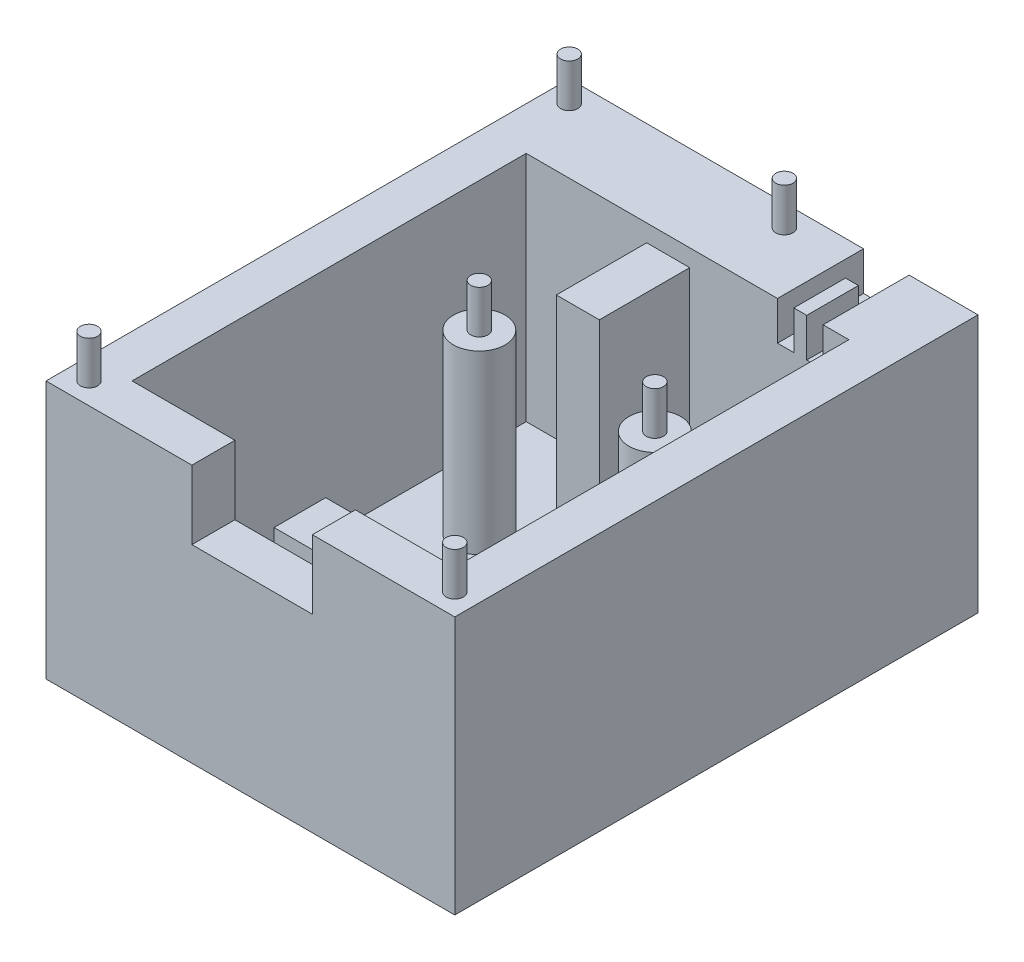
from build123d import *

# Parameters (mm, degrees)
SKETCH_1_W          = 47.5
SKETCH_1_H          = 60.8
EXTRUDE_1_DEPTH     = 30
SKETCH_2_R          = 1
EXTRUDE_3_DEPTH     = 5
SKETCH_3_W          = 37.5
SKETCH_3_H          = 45.8
CUT_EXTRUDE_1_DEPTH = 27
SKETCH_4_W          = 14
SKETCH_4_H          = 5
CUT_EXTRUDE_2_DEPTH = 8
SKETCH_5_R          = 3
SKETCH_5_W          = 6
SKETCH_5_H          = 6
EXTRUDE_4_DEPTH     = 20.5
SKETCH_6_W          = 5
SKETCH_6_H          = 10.5
EXTRUDE_6_DEPTH     = 25
SKETCH_7_R          = 1
EXTRUDE_7_DEPTH     = 5
SKETCH_12_W         = 5.3
SKETCH_12_H         = 4.5
CUT_EXTRUDE_5_DEPTH = 10
SKETCH_13_W         = 1.5
SKETCH_13_H         = 6
EXTRUDE_8_DEPTH     = 4.5


with BuildPart() as part:
    # 草图1 → 凸台-拉伸1 (new body)
    with BuildSketch(Plane(origin=(0, 0, 0), x_dir=(1, 0, 0), z_dir=(0, 1, 0))):
        with Locations((-26.283333333, -1.583333333)):
            Rectangle(SKETCH_1_W, SKETCH_1_H)
    extrude(amount=EXTRUDE_1_DEPTH)

    # 草图2 → 凸台-拉伸3 (add)
    with BuildSketch(Plane(origin=(0, 30, 0), x_dir=(1, 0, 0), z_dir=(0, 1, 0))):
        with Locations(Location((-22.533333333, 26.316666667, 0), (0, 0, 270))):
            Circle(SKETCH_2_R)
        with Locations(Location((-47.533333333, 26.316666667, 0), (0, 0, 270))):
            Circle(SKETCH_2_R)
        with Locations(Location((-47.533333333, -29.483333333, 0), (0, 0, 270))):
            Circle(SKETCH_2_R)
        with Locations(Location((-5.033333333, -29.483333333, 0), (0, 0, 270))):
            Circle(SKETCH_2_R)
    extrude(amount=EXTRUDE_3_DEPTH)

    # 草图3 → 切除-拉伸1 (cut)
    with BuildSketch(Plane(origin=(0, 30, 0), x_dir=(1, 0, 0), z_dir=(0, 1, 0))):
        with Locations((-26.283333333, -4.083333333)):
            Rectangle(SKETCH_3_W, SKETCH_3_H)
    extrude(amount=-CUT_EXTRUDE_1_DEPTH, mode=Mode.SUBTRACT)

    # 草图4 → 切除-拉伸2 (cut)
    with BuildSketch(Plane(origin=(0, 30, 0), x_dir=(1, 0, 0), z_dir=(0, 1, 0))):
        with Locations((-26.083333333, -29.483333333)):
            Rectangle(SKETCH_4_W, SKETCH_4_H)
    extrude(amount=-CUT_EXTRUDE_2_DEPTH, mode=Mode.SUBTRACT)

    # 草图5 → 凸台-拉伸4 (add)
    with BuildSketch(Plane(origin=(0, 3, 0), x_dir=(1, 0, 0), z_dir=(0, 1, 0))):
        with Locations(Location((-16.083333333, 4.816666667, 0), (0, 0, 270))):
            Circle(SKETCH_5_R)
        with Locations(Location((-36.483333333, 4.816666667, 0), (0, 0, 270))):
            Circle(SKETCH_5_R)
        with Locations((-25.533333333, -23.983333333)):
            Rectangle(SKETCH_5_W, SKETCH_5_H)
    extrude(amount=EXTRUDE_4_DEPTH)

    # 草图6 → 凸台-拉伸6 (add)
    with BuildSketch(Plane(origin=(0, 3, 0), x_dir=(1, 0, 0), z_dir=(0, 1, 0))):
        with Locations((-28.533333333, 13.566666667)):
            Rectangle(SKETCH_6_W, SKETCH_6_H)
    extrude(amount=EXTRUDE_6_DEPTH)

    # 草图7 → 凸台-拉伸7 (add)
    with BuildSketch(Plane(origin=(0, 23.5, 0), x_dir=(1, 0, 0), z_dir=(0, 1, 0))):
        with Locations(Location((-36.483333333, 4.816666667, 0), (0, 0, 270))):
            Circle(SKETCH_7_R)
        with Locations(Location((-16.083333333, 4.816666667, 0), (0, 0, 270))):
            Circle(SKETCH_7_R)
    extrude(amount=EXTRUDE_7_DEPTH)

    # 草图12 → 切除-拉伸5 (cut)
    with BuildSketch(Plane(origin=(0, 0, -28.816666667), x_dir=(-1, 0, 0), z_dir=(0, 0, -1))):
        with Locations((13.183333333, 27.75)):
            Rectangle(SKETCH_12_W, SKETCH_12_H)
    extrude(amount=-CUT_EXTRUDE_5_DEPTH, mode=Mode.SUBTRACT)

    # 草图13 → 凸台-拉伸8 (add)
    with BuildSketch(Plane(origin=(0, 25.5, 0), x_dir=(1, 0, 0), z_dir=(0, 1, 0))):
        with Locations((-13.183333333, 21.816666667)):
            Rectangle(SKETCH_13_W, SKETCH_13_H)
    extrude(amount=EXTRUDE_8_DEPTH)


solid = part.part
